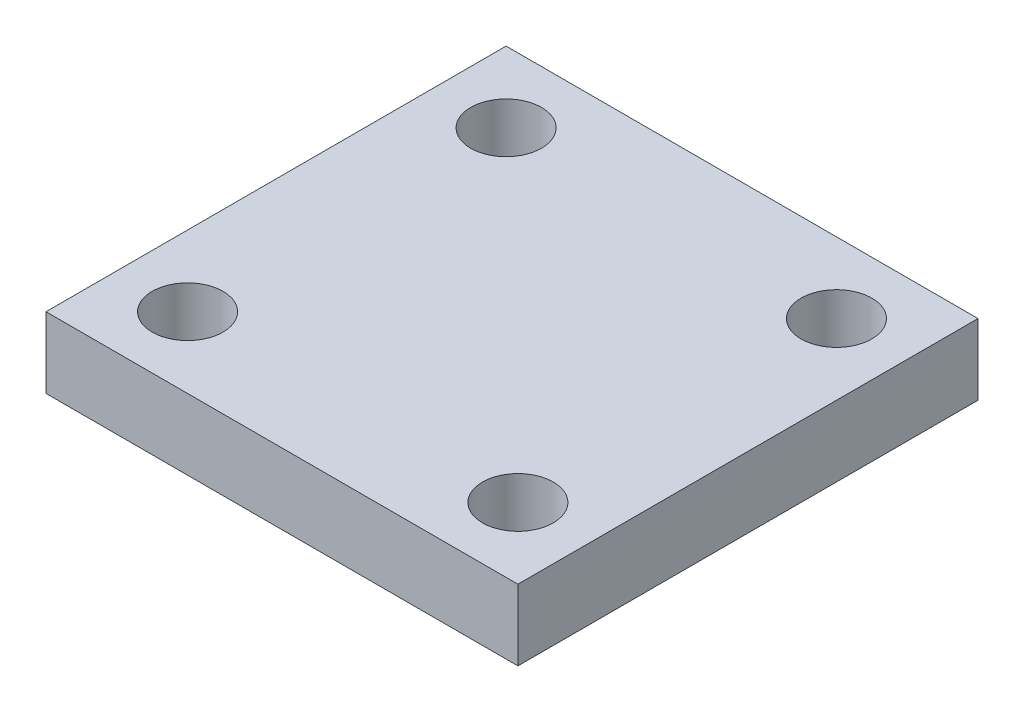
from build123d import *

# Parameters (mm, degrees)
SKETCH1_W           = 20
SKETCH1_H           = 19.5
SKETCH1_R           = 1.5
BOSS_EXTRUDE1_DEPTH = 3


with BuildPart() as part:
    # Sketch1 → Boss-Extrude1 (new body)
    with BuildSketch(Plane(origin=(0, 0, 0), x_dir=(1, 0, 0), z_dir=(0, 1, 0))):
        with Locations((10, 9.75)):
            Rectangle(SKETCH1_W, SKETCH1_H)
        with Locations(Location((3, 3, 0), (0, 0, 270))):
            Circle(SKETCH1_R, mode=Mode.SUBTRACT)
        with Locations(Location((17, 3, 0), (0, 0, 270))):
            Circle(SKETCH1_R, mode=Mode.SUBTRACT)
        with Locations(Location((17, 16.5, 0), (0, 0, 270))):
            Circle(SKETCH1_R, mode=Mode.SUBTRACT)
        with Locations(Location((3, 16.5, 0), (0, 0, 270))):
            Circle(SKETCH1_R, mode=Mode.SUBTRACT)
    extrude(amount=BOSS_EXTRUDE1_DEPTH)


solid = part.part
